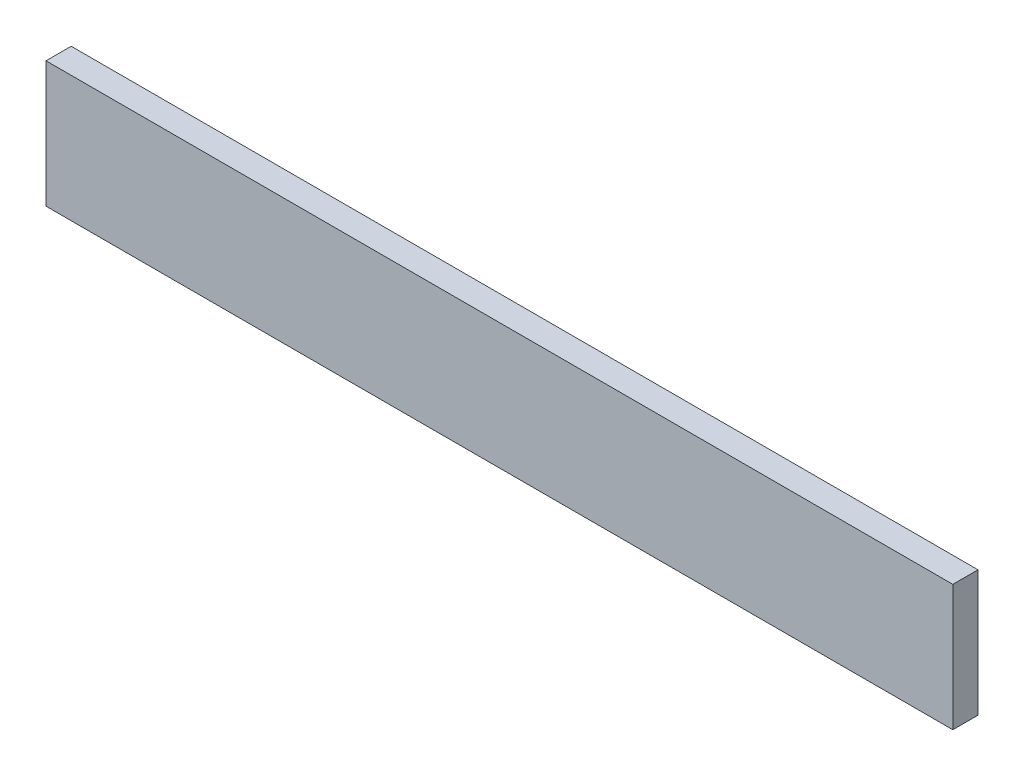
from build123d import *

# Parameters (mm, degrees)
SKETCH1_W           = 54
SKETCH1_H           = 7.5
BOSS_EXTRUDE1_DEPTH = 1.5
SCALE1_SCALE        = 10


with BuildPart() as part:
    # Sketch1 → Boss-Extrude1 (new body)
    with BuildSketch(Plane.XY):
        with Locations((27, 3.75)):
            Rectangle(SKETCH1_W, SKETCH1_H)
    extrude(amount=BOSS_EXTRUDE1_DEPTH)


with BuildPart() as part_1:
    # Scale1: scaled about (0, 0, 0)
    add(part.part.scale(SCALE1_SCALE))


solid = part_1.part
